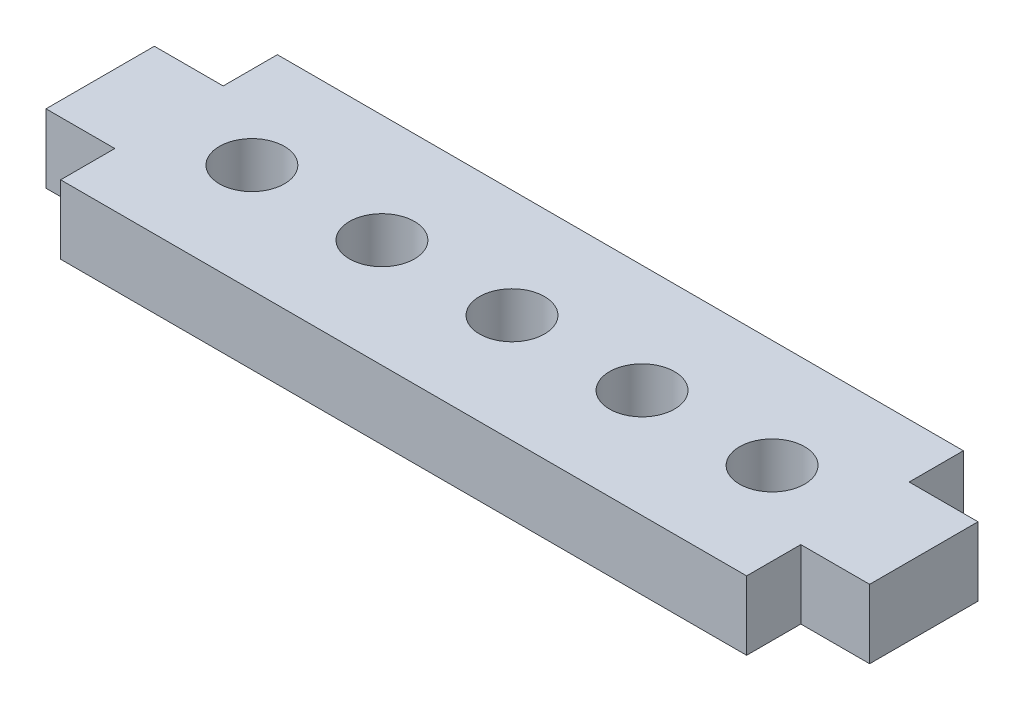
from build123d import *

# Parameters (mm, degrees)
SKETCH1_R           = 3
BOSS_EXTRUDE1_DEPTH = 6.35


with BuildPart() as part:
    # Sketch1 → Boss-Extrude1 (new body)
    with BuildSketch(Plane(origin=(0, 0, 0), x_dir=(1, 0, 0), z_dir=(0, 1, 0))):
        Polygon((0, 0), (63.3, 0), (63.3, 5), (69.65, 5), (69.65, 15), (63.3, 15), (63.3, 20), (0, 20), (0, 15), (-6.35, 15), (-6.35, 5), (0, 5), align=None)
        with Locations(Location((7.65, 10, 0), (0, 0, 270))):
            Circle(SKETCH1_R, mode=Mode.SUBTRACT)
        with Locations(Location((19.65, 10, 0), (0, 0, 270))):
            Circle(SKETCH1_R, mode=Mode.SUBTRACT)
        with Locations(Location((31.65, 10, 0), (0, 0, 270))):
            Circle(SKETCH1_R, mode=Mode.SUBTRACT)
        with Locations(Location((43.65, 10, 0), (0, 0, 270))):
            Circle(SKETCH1_R, mode=Mode.SUBTRACT)
        with Locations(Location((55.65, 10, 0), (0, 0, 270))):
            Circle(SKETCH1_R, mode=Mode.SUBTRACT)
    extrude(amount=BOSS_EXTRUDE1_DEPTH)


solid = part.part
